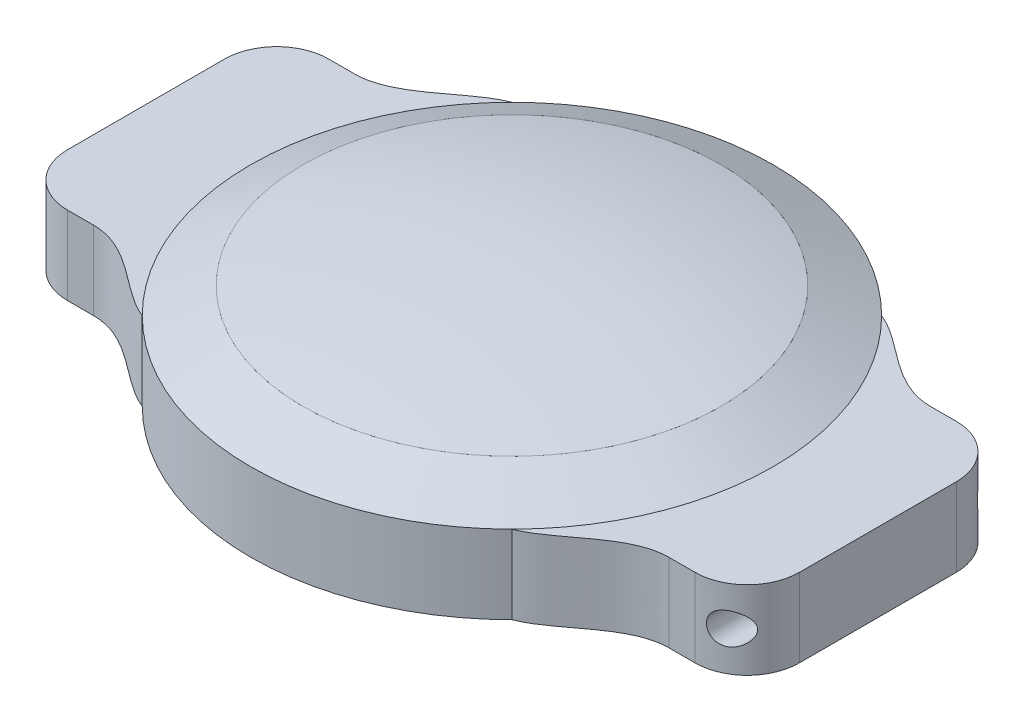
from build123d import *

# Parameters (mm, degrees)
SKETCH2_R               = 0.35
CUT_EXTRUDE2_DEPTH      = 0.05
SKETCH3_W               = 0.02
SKETCH3_H               = 0.16
CUT_EXTRUDE3_DEPTH      = 0.01
CIRPATTERN1_COUNT       = 12
SKETCH6_R               = 0.025
BOSS_EXTRUDE2_DEPTH     = 0.02
BOSS_EXTRUDE3_DEPTH     = 0.01
BOSS_EXTRUDE4_DEPTH     = 0.01
BOSS_EXTRUDE5_DEPTH     = 0.15
FILLET2_R               = 0.1
FILLET2_OF_MIRROR1_R    = 0.1
CUT_EXTRUDE4_DEPTH      = 2.055935765
CUT_EXTRUDE4_DEPTH_BACK = 2.055935765
SKETCH11_R              = 0.03


with BuildPart() as part:
    # Sketch1 → Revolve1 (revolve)
    with BuildSketch(Plane.XY, mode=Mode.PRIVATE) as revolve1_sk:
        Polygon((0, 0), (0.5, 0), (0.5, 0.15), (0.4, 0.2), (0, 0.2), align=None)
    revolve(revolve1_sk.sketch.rotate(Axis((0, 0.2, 0), (0, -1, 0)), 180), axis=Axis((0, 0.2, 0), (0, -1, 0)))

    # Sketch2 → Cut-Extrude2 (cut)
    with BuildSketch(Plane(origin=(0, 0.2, 0), x_dir=(1, 0, 0), z_dir=(0, 1, 0))):
        with Locations(Location((0, 0, 0), (0, 0, 180))):
            Circle(SKETCH2_R)
    extrude(amount=-CUT_EXTRUDE2_DEPTH, mode=Mode.SUBTRACT)

    # Sketch3 → Cut-Extrude3 (cut)
    with BuildSketch(Plane(origin=(0, 0.15, 0), x_dir=(1, 0, 0), z_dir=(0, 1, 0))):
        with Locations((0, 0.27)):
            Rectangle(SKETCH3_W, SKETCH3_H)
    cut_extrude3 = extrude(amount=-CUT_EXTRUDE3_DEPTH, mode=Mode.SUBTRACT)

    # CirPattern1: Cut-Extrude3 ×12 about axis
    cirpattern1_axis = Axis((0, 0, 0.002263004), (0, 1, 0))
    for i in range(1, CIRPATTERN1_COUNT):
        add(cut_extrude3.rotate(cirpattern1_axis, i * 360 / CIRPATTERN1_COUNT), mode=Mode.SUBTRACT)

    # Sketch4 → Revolve2 (revolve)
    with BuildSketch(Plane.XY):
        with BuildLine():
            Line((0, 0.15), (0.15, 0.15))
            ThreePointArc((0.15, 0.15), (0.075666667, 0.165000001), (0, 0.17))
            Line((0, 0.17), (0, 0.15))
        make_face()
    revolve(axis=Axis((0, 0, 0), (0, 1, 0)))

    # Sketch6 → Boss-Extrude2 (add)
    with BuildSketch(Plane(origin=(0, 0.15, 0), x_dir=(1, 0, 0), z_dir=(0, 1, 0))):
        with Locations(Location((0, 0, 0), (0, 0, 90))):
            Circle(SKETCH6_R)
    extrude(amount=BOSS_EXTRUDE2_DEPTH)

    # Sketch7 → Boss-Extrude3 (add)
    with BuildSketch(Plane(origin=(0, 0.17, 0), x_dir=(1, 0, 0), z_dir=(0, 1, 0))):
        with BuildLine():
            Line((-0.012945559, 0.007577104), (0.138596523, 0.266488281))
            ThreePointArc((0.138596523, 0.266488281), (0.159119186, 0.271856735), (0.164487641, 0.251334072))
            Line((0.164487641, 0.251334072), (0.012945559, -0.007577104))
            ThreePointArc((0.012945559, -0.007577104), (-0.007577104, -0.012945559), (-0.012945559, 0.007577104))
        make_face()
    extrude(amount=BOSS_EXTRUDE3_DEPTH)

    # Sketch9 → Boss-Extrude4 (add)
    with BuildSketch(Plane(origin=(0, 0.17, 0), x_dir=(1, 0, 0), z_dir=(0, 1, 0))):
        with BuildLine():
            Line((-0.011588664, -0.009523806), (-0.13857274, 0.14499171))
            ThreePointArc((-0.13857274, 0.14499171), (-0.136507882, 0.166104179), (-0.115395412, 0.164039321))
            Line((-0.115395412, 0.164039321), (0.011588664, 0.009523806))
            ThreePointArc((0.011588664, 0.009523806), (0.009523806, -0.011588664), (-0.011588664, -0.009523806))
        make_face()
    extrude(amount=BOSS_EXTRUDE4_DEPTH)

    # Sketch10 → Boss-Extrude5 (add)
    with BuildSketch(Plane.XZ):
        with BuildLine():
            Line((0.55, -0.25), (0.7, -0.25))
            Line((0.7, -0.25), (0.7, 0.25))
            Line((0.7, 0.25), (0.55, 0.25))
            add(Edge.make_bspline(
                [(0.55, 0.25), (0.474025332, 0.25), (0.413386231, 0.330923034), (0.353553391, 0.353553391)],
                knots=[0, 0, 0, 0, 1, 1, 1, 1], degree=3))
            Line((0.353553391, 0.353553391), (0.353553391, -0.353553391))
            add(Edge.make_bspline(
                [(0.55, -0.25), (0.474025332, -0.25), (0.413386231, -0.330923034), (0.353553391, -0.353553391)],
                knots=[0, 0, 0, 0, 1, 1, 1, 1], degree=3))
        make_face()
    boss_extrude5 = extrude(amount=-BOSS_EXTRUDE5_DEPTH)

    # Fillet2
    fillet2_edges = [part.edges().sort_by_distance(p)[0] for p in [
        (0.7, 0.075, -0.25),
        (0.7, 0.075, 0.25),
    ]]
    fillet(fillet2_edges, radius=FILLET2_R)

    # Mirror1: Boss-Extrude5 across plane
    add(boss_extrude5.mirror(Plane(origin=(0, 0, 0), x_dir=(0, 0, 1), z_dir=(1, 0, 0))))

    # Fillet2 of Mirror1
    fillet2_of_mirror1_edges = [part.edges().sort_by_distance(p)[0] for p in [
        (-0.7, 0.075, -0.25),
        (-0.7, 0.075, 0.25),
    ]]
    fillet(fillet2_of_mirror1_edges, radius=FILLET2_OF_MIRROR1_R)

    # Sketch11 → Cut-Extrude4 (cut, two sides: drawn at the far end of the back side and taken through both)
    with BuildSketch(Plane.XY.offset(0.25).offset(-CUT_EXTRUDE4_DEPTH_BACK)):
        with Locations((0.65, 0.075)):
            Circle(SKETCH11_R)
    extrude(amount=CUT_EXTRUDE4_DEPTH + CUT_EXTRUDE4_DEPTH_BACK, mode=Mode.SUBTRACT)


with BuildPart() as body_2:
    # Sketch8 → Revolve3 (revolve)
    with BuildSketch(Plane.XY, mode=Mode.PRIVATE) as revolve3_sk:
        with BuildLine():
            Line((0, 0.23), (0, 0.25))
            ThreePointArc((0, 0.25), (-0.201551632, 0.237413059), (-0.4, 0.2))
            Line((-0.4, 0.2), (-0.35, 0.2))
            ThreePointArc((-0.35, 0.2), (-0.175501439, 0.220850122), (0, 0.23))
        make_face()
    revolve(revolve3_sk.sketch.rotate(Axis((0, 0.23, 0), (0, 1, 0)), 270), axis=Axis((0, 0.23, 0), (0, 1, 0)))


solid = Compound([part.part, body_2.part])
